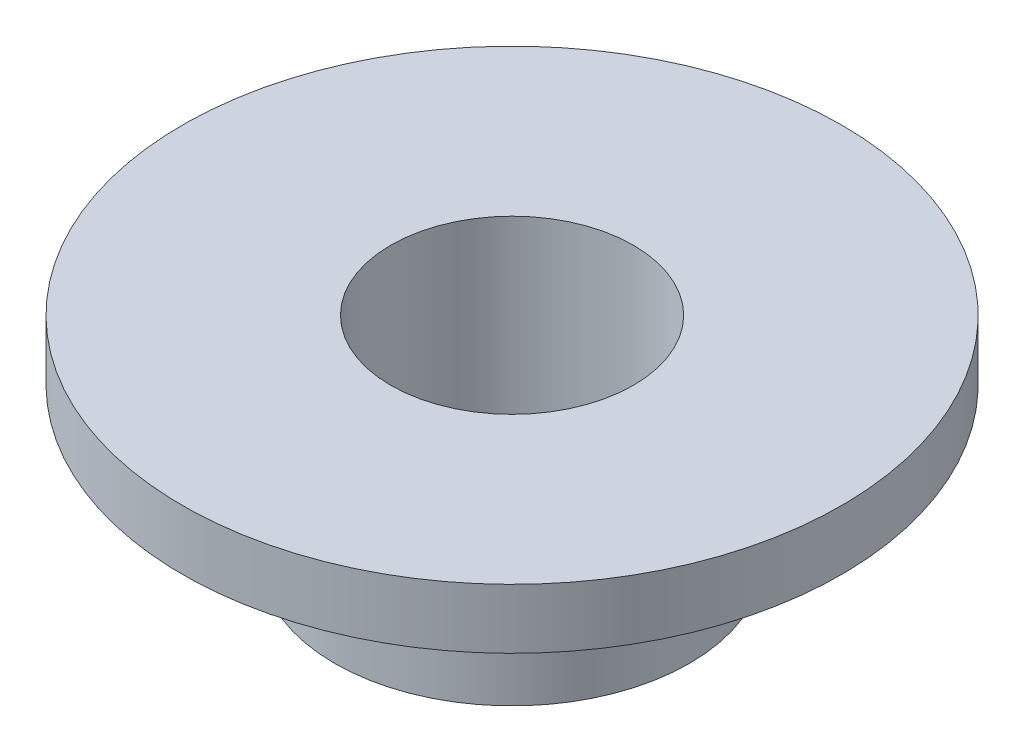
from build123d import *


with BuildPart() as part:
    # Esquisse1 → Révolution1 (revolve)
    with BuildSketch(Plane.XY.offset(10.400028379), mode=Mode.PRIVATE) as r_volution1_sk:
        Polygon((41.3577939, -27.63714263), (41.3577939, -23.53714263), (45.4327939, -23.53714263), (45.4327939, -21.93714263), (39.8577939, -21.93714263), (39.8577939, -27.63714263), align=None)
    revolve(r_volution1_sk.sketch.rotate(Axis((36.6077939, -21.93714263, 10.400028379), (0, -1, 0)), 270), axis=Axis((36.6077939, -21.93714263, 10.400028379), (0, -1, 0)))


solid = part.part
